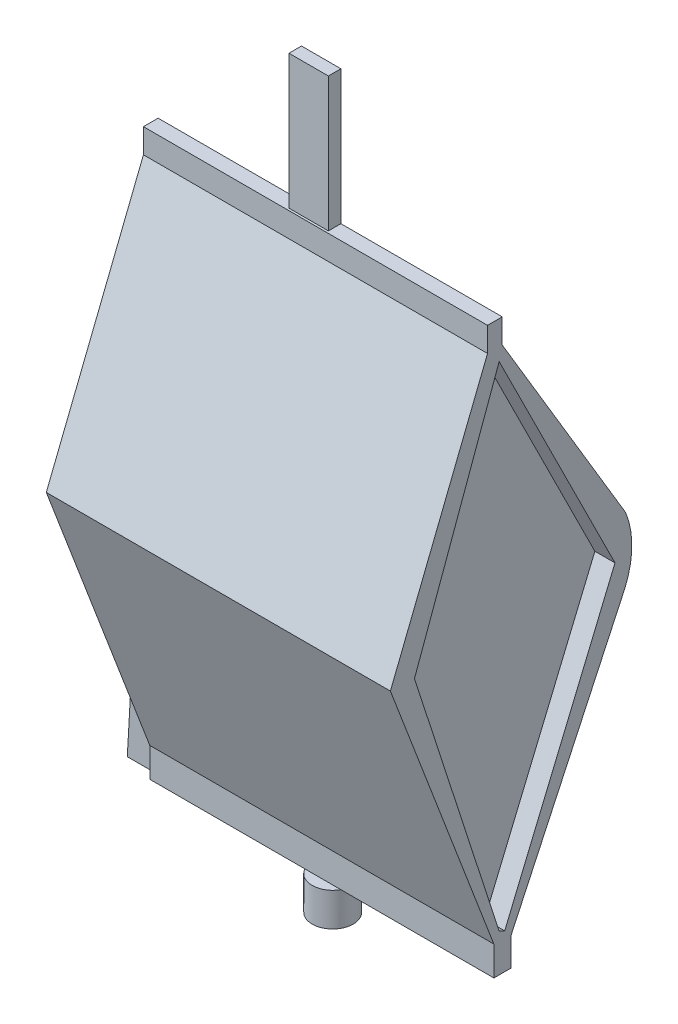
from build123d import *

# Parameters (mm, degrees)
SKETCH4_W           = 62.83623107
SKETCH4_H           = 84.722256574
BOSS_EXTRUDE2_DEPTH = 50
CUT_EXTRUDE2_DEPTH  = 80
CUT_EXTRUDE3_DEPTH  = 80
CUT_EXTRUDE5_DEPTH  = 80
CUT_EXTRUDE6_DEPTH  = 3
CUT_EXTRUDE8_DEPTH  = 80
CUT_EXTRUDE9_DEPTH  = 80
SKETCH11_W          = 5.870888161
SKETCH11_H          = 1.865764547
BOSS_EXTRUDE3_DEPTH = 20
SCALE1_SCALE        = 0.5
SCALE2_SCALE        = 0.4
SCALE3_SCALE        = 0.5
SCALE5_SCALE        = 4
SKETCH13_R          = 1.221118876
BOSS_EXTRUDE4_DEPTH = 2


with BuildPart() as part:
    # Sketch4 → Boss-Extrude2 (new body)
    with BuildSketch(Plane.XY):
        Rectangle(SKETCH4_W, SKETCH4_H)
    extrude(amount=BOSS_EXTRUDE2_DEPTH)

    # Sketch5 → Cut-Extrude2 (cut)
    with BuildSketch(Plane(origin=(31.418115535, 0, 0), x_dir=(0, 0, -1), z_dir=(1, 0, 0))):
        Polygon((-31.846034257, 38.728174008), (-31.846034257, 42.361128287), (-50, 42.361128287), (-50, -42.361128287), (-30.898434646, -42.361128287), (-30.898434646, -37.982426726), (-46.322270236, 2.38891709), align=None)
    extrude(amount=-CUT_EXTRUDE2_DEPTH, mode=Mode.SUBTRACT)

    # Sketch6 → Cut-Extrude3 (cut)
    with BuildSketch(Plane(origin=(31.418115535, 0, 0), x_dir=(0, 0, -1), z_dir=(1, 0, 0))):
        Polygon((-29.655383969, 42.361128287), (-29.655383969, 38.722554473), (-8.776416022, 3.750158878), (-28.328453067, -38.117745), (-28.328453067, -42.361128287), (-27.677514405, -46.625913761), (16.839811583, -52.045359618), (10.267667228, 27.190343951), (3.73953172, 54.484047391), align=None)
    extrude(amount=-CUT_EXTRUDE3_DEPTH, mode=Mode.SUBTRACT)

    # Sketch7 → Cut-Extrude5 (cut)
    with BuildSketch(Plane.ZY.offset(31.418115535)):
        with BuildLine():
            ThreePointArc((13.228873585, 11.208051798), (10.417703783, 4.563945687), (11.71087014, -2.533556863))
            ThreePointArc((11.71087014, -2.533556863), (0.747619784, 5.632177302), (13.228873585, 11.208051798))
        make_face()
    extrude(amount=-CUT_EXTRUDE5_DEPTH, mode=Mode.SUBTRACT)

    # Sketch8 → Cut-Extrude6 (cut)
    with BuildSketch(Plane(origin=(31.418115535, 0, 0), x_dir=(0, 0, -1), z_dir=(1, 0, 0))):
        Polygon((-30.111598921, 36.817435747), (-42.735074125, 2.19595341), (-30.111598921, -36.694083179), (-29.289064541, -37.07820135), (-12.845557678, 2.19595341), align=None)
    extrude(amount=-CUT_EXTRUDE6_DEPTH, mode=Mode.SUBTRACT)

    # Sketch9 → Cut-Extrude8 (cut)
    with BuildSketch(Plane(origin=(0, 0, 29.655383969), x_dir=(-1, 0, 0), z_dir=(0, 0, -1))):
        Polygon((19.869908303, 42.361128287), (19.869908303, 38.722554473), (19.869908303, 5.586987563), (19.869908303, -4.186945454), (19.869908303, -38.208459621), (19.869908303, -42.059759196), (19.869908303, -47.026854784), (41.256673117, -49.585938288), (42.081255469, -21.197702537), (42.081255469, 12.428184914), (37.482224788, 37.513066745), (31.418115535, 49.4837873), align=None)
    extrude(amount=-CUT_EXTRUDE8_DEPTH, mode=Mode.SUBTRACT)

    # Sketch10 → Cut-Extrude9 (cut)
    with BuildSketch(Plane(origin=(0, -2.877407212, 4.819674209), x_dir=(-1, 0, 0), z_dir=(0, 0.5126085745439567, -0.8586224136976701))):
        Polygon((19.869908303, 48.44965729), (25.693686727, -39.803296282), (32.448126733, -43.444815965), (49.802642339, -43.444815965), (32.448126733, 57.840856492), align=None)
    extrude(amount=-CUT_EXTRUDE9_DEPTH, mode=Mode.SUBTRACT)

    # Sketch11 → Boss-Extrude3 (add)
    with BuildSketch(Plane(origin=(0, 42.361128287, 0), x_dir=(1, 0, 0), z_dir=(0, 1, 0))):
        with Locations((4.437413085, -30.588266243)):
            Rectangle(SKETCH11_W, SKETCH11_H)
    extrude(amount=BOSS_EXTRUDE3_DEPTH)


with BuildPart() as part_1:
    # Scale1: scaled about (4.044501914, 0.935318094, 28.406526913)
    add(part.part.scale(SCALE1_SCALE).moved(Location((2.022250957, 0.467659047, 14.203263457))))


with BuildPart() as part_2:
    # Scale2: scaled about (4.044501914, 0.935318094, 28.406526913)
    add(part_1.part.scale(SCALE2_SCALE).moved(Location((2.426701148, 0.561190856, 17.043916148))))


with BuildPart() as part_3:
    # Scale3: scaled about (4.044501914, 0.935318094, 28.406526913)
    add(part_2.part.scale(SCALE3_SCALE).moved(Location((2.022250957, 0.467659047, 14.203263457))))


with BuildPart() as part_4:
    # Scale5: scaled about (4.044501914, 0.935318094, 28.406526913)
    add(part_3.part.scale(SCALE5_SCALE).moved(Location((-12.133505742, -2.805954282, -85.219580739))))


with BuildPart() as boss_extrude4_tool:
    # Sketch13 → Boss-Extrude4 (new body)
    with BuildSketch(Plane(origin=(0, -16.38326151, 0), x_dir=(-1, 0, 0), z_dir=(0, -1, 0))):
        with Locations(Location((-4.797778916, -28.817556161, 0), (0, 0, 331.33607571))):
            Circle(SKETCH13_R)
    extrude(amount=BOSS_EXTRUDE4_DEPTH)


with BuildPart() as part_5:
    add(part_4.part)


with BuildPart() as part_6:
    # Boss-Extrude4: joined with boss_extrude4_tool
    add(part_5.part.fuse(boss_extrude4_tool.part, tol=0.00001))


solid = part_6.part
